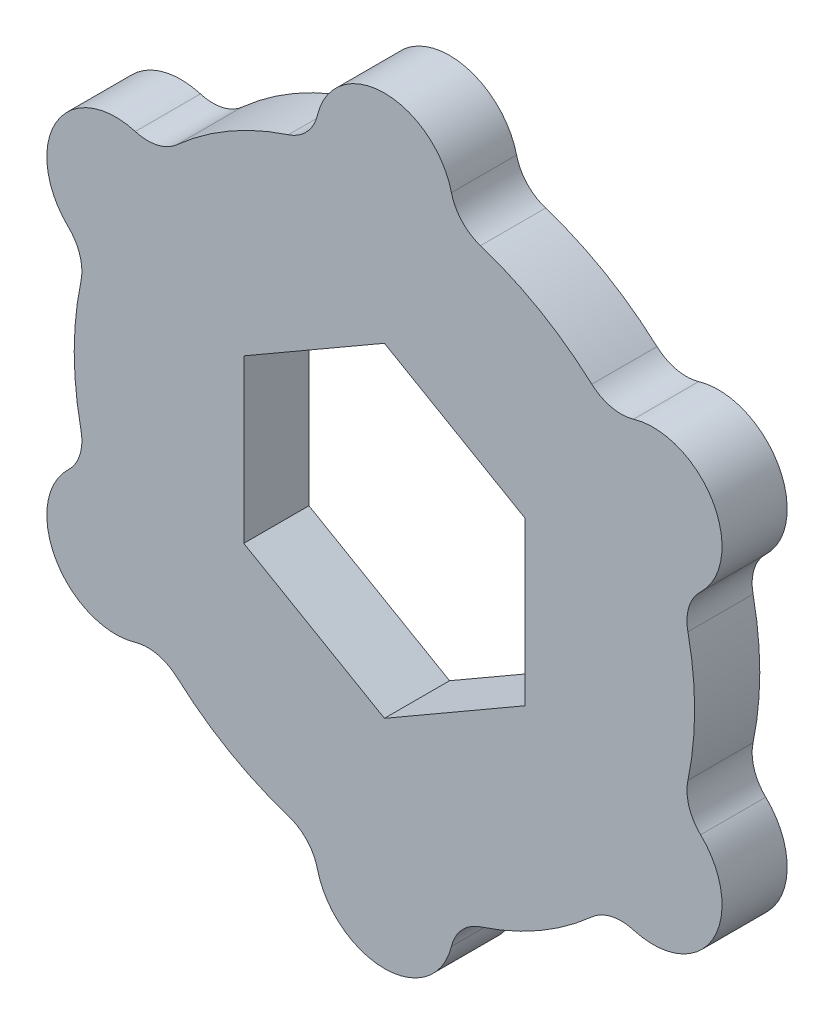
from build123d import *

# Parameters (mm, degrees)
BOSS_EXTRUDE1_DEPTH = 1.499997
FILLET1_R           = 2.0193


with BuildPart() as part:
    # Sketch1 → Boss-Extrude1 (new, symmetric)
    with BuildSketch(Plane.XY):
        with BuildLine():
            ThreePointArc((-13.645493623, 4.234756195), (-14.2875, 0), (-13.645493623, -4.234756195))
            ThreePointArc((-13.645493623, -4.234756195), (-15.122968614, -8.73125), (-10.490153255, -9.699966028))
            ThreePointArc((-10.490153255, -9.699966028), (-7.14375, -12.373337957), (-3.155340368, -13.934722222))
            ThreePointArc((-3.155340368, -13.934722222), (0, -17.4625), (3.155340368, -13.934722222))
            ThreePointArc((3.155340368, -13.934722222), (7.14375, -12.373337957), (10.490153255, -9.699966028))
            ThreePointArc((10.490153255, -9.699966028), (15.122968614, -8.73125), (13.645493623, -4.234756195))
            ThreePointArc((13.645493623, -4.234756195), (14.2875, 0), (13.645493623, 4.234756195))
            ThreePointArc((13.645493623, 4.234756195), (15.122968614, 8.73125), (10.490153255, 9.699966028))
            ThreePointArc((10.490153255, 9.699966028), (7.14375, 12.373337957), (3.155340368, 13.934722222))
            ThreePointArc((3.155340368, 13.934722222), (0, 17.4625), (-3.155340368, 13.934722222))
            ThreePointArc((-3.155340368, 13.934722222), (-7.14375, 12.373337957), (-10.490153255, 9.699966028))
            ThreePointArc((-10.490153255, 9.699966028), (-15.122968614, 8.73125), (-13.645493623, 4.234756195))
        make_face()
        Polygon((0, 7.478995387), (-6.477, 3.739497694), (-6.477, -3.739497694), (0, -7.478995387), (6.477, -3.739497694), (6.477, 3.739497694), align=None, mode=Mode.SUBTRACT)
    extrude(amount=BOSS_EXTRUDE1_DEPTH, both=True)

    # Fillet1
    fillet1_edges = [part.edges().sort_by_distance(p)[0] for p in [
        (10.490153255, 9.699966028, 0),
        (13.645493623, 4.234756195, 0),
        (13.645493623, -4.234756195, 0),
        (10.490153255, -9.699966028, 0),
        (3.155340368, -13.934722222, 0),
        (-3.155340368, -13.934722222, 0),
        (-10.490153255, -9.699966028, 0),
        (-13.645493623, -4.234756195, 0),
        (-13.645493623, 4.234756195, 0),
        (-10.490153255, 9.699966028, 0),
        (-3.155340368, 13.934722222, 0),
        (3.155340368, 13.934722222, 0),
    ]]
    fillet(fillet1_edges, radius=FILLET1_R)


solid = part.part
